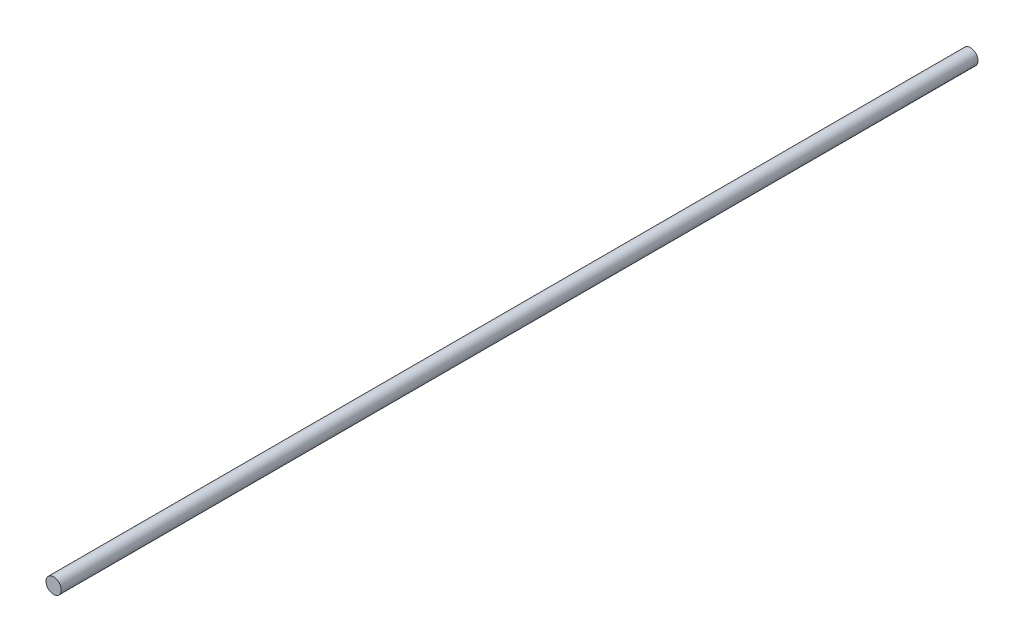
from build123d import *

# Parameters (mm, degrees)
SKETCH1_R           = 1
BOSS_EXTRUDE1_DEPTH = 120


with BuildPart() as part:
    # Sketch1 → Boss-Extrude1 (new body)
    with BuildSketch(Plane.XY):
        Circle(SKETCH1_R)
    extrude(amount=BOSS_EXTRUDE1_DEPTH)


solid = part.part
